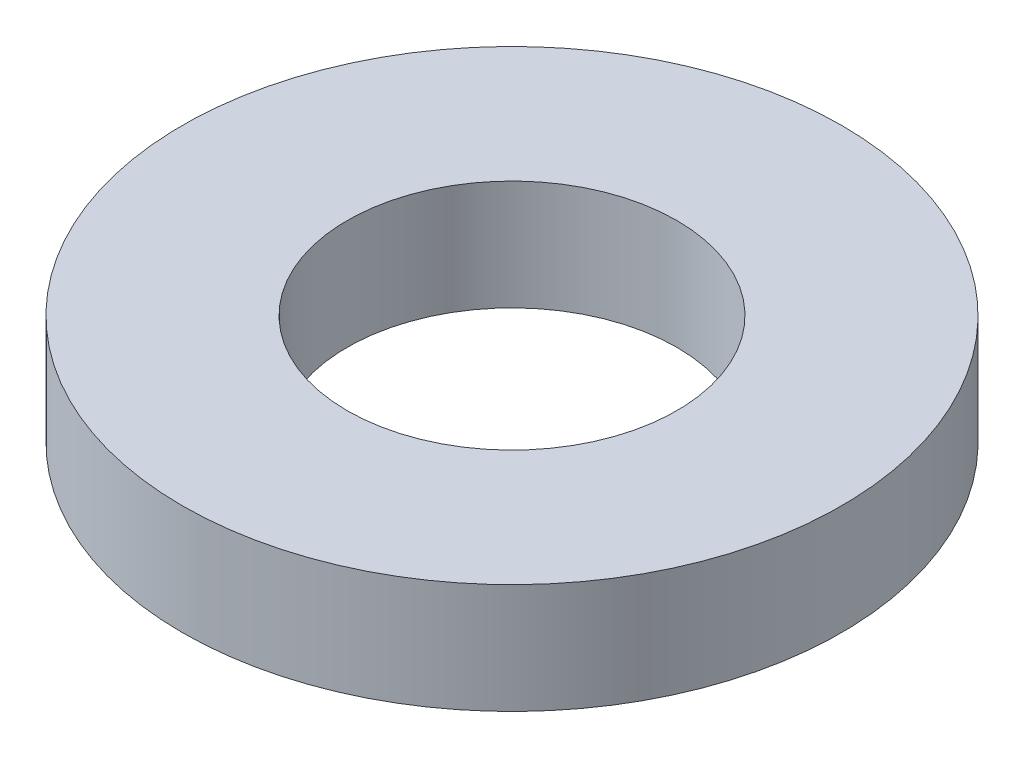
from build123d import *

# Parameters (mm, degrees)
SKETCH_1_R      = 30
SKETCH_1_R_2    = 15
EXTRUDE_1_DEPTH = 10


with BuildPart() as part:
    # Эскиз1 → Бобышка-Вытянуть1 (new body)
    with BuildSketch(Plane(origin=(0, 0, 0), x_dir=(1, 0, 0), z_dir=(0, 1, 0))):
        with Locations(Location((0, 0, 0), (0, 0, 270))):
            Circle(SKETCH_1_R)
        with Locations(Location((0, 0, 0), (0, 0, 270))):
            Circle(SKETCH_1_R_2, mode=Mode.SUBTRACT)
    extrude(amount=EXTRUDE_1_DEPTH)


solid = part.part
